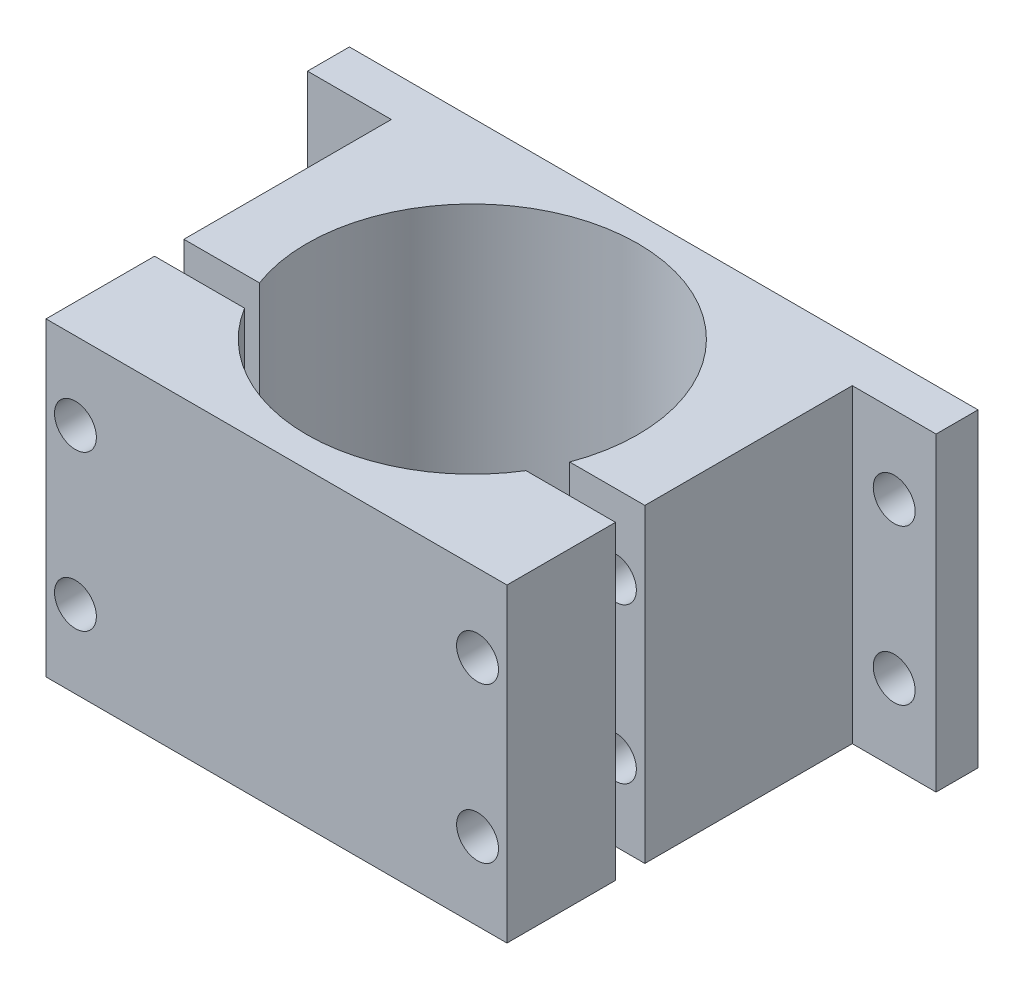
from build123d import *

# Parameters (mm, degrees)
SKETCH1_W              = 75
SKETCH1_H              = 37
BOSS_EXTRUDE1_DEPTH    = 5
SKETCH19_W             = 55
SKETCH19_H             = 37
BOSS_EXTRUDE5_DEPTH    = 41.2
SKETCH20_R             = 19.75
CUT_EXTRUDE7_DEPTH     = 71.069180101
SKETCH22_R             = 2.498129319
CUT_EXTRUDE8_DEPTH     = 25
SPLIT1_SURFACE_1_BACK  = 96.543
SPLIT1_SURFACE_1_DEPTH = 193.086
SPLIT1_SURFACE_2_BACK  = 96.543
SPLIT1_SURFACE_2_DEPTH = 193.086
SKETCH23_R             = 2.5
CUT_EXTRUDE9_DEPTH     = 59.702129433
SKETCH24_W             = 55
SKETCH24_H             = 3.5
CUT_EXTRUDE10_DEPTH    = 71.069180101


with BuildPart() as part:
    # Sketch1 → Boss-Extrude1 (new body)
    with BuildSketch(Plane.XY):
        Rectangle(SKETCH1_W, SKETCH1_H)
    extrude(amount=BOSS_EXTRUDE1_DEPTH)

    # Sketch19 → Boss-Extrude5 (add)
    with BuildSketch(Plane.XY.offset(5)):
        Rectangle(SKETCH19_W, SKETCH19_H)
    extrude(amount=BOSS_EXTRUDE5_DEPTH)

    # Sketch20 → Cut-Extrude7 (cut, through all)
    with BuildSketch(Plane(origin=(0, 18.5, 0), x_dir=(1, 0, 0), z_dir=(0, 1, 0))):
        with Locations(Location((0.023568345, -22.855008575, 0), (0, 0, 270))):
            Circle(SKETCH20_R)
    extrude(amount=-CUT_EXTRUDE7_DEPTH, mode=Mode.SUBTRACT)

    # Sketch22 → Cut-Extrude8 (cut)
    with BuildSketch(Plane.XY.offset(46.2)):
        with Locations((-23.988215828, 9.25)):
            Circle(SKETCH22_R)
        with Locations(Location((-23.988215828, -9.25, 0), (0, 0, 180))):
            Circle(SKETCH22_R)
        with Locations((23.988215828, -9.25)):
            Circle(SKETCH22_R)
        with Locations(Location((23.988215828, 9.25, 0), (0, 0, 180))):
            Circle(SKETCH22_R)
    extrude(amount=-CUT_EXTRUDE8_DEPTH, mode=Mode.SUBTRACT)


with BuildPart() as body_2:
    # Split1: the piece behind the surface
    add(part.part)
    # Split1 surface: a surface, the sketch's curves swept straight by 193.086 mm
    with BuildLine(Plane(origin=(0, 18.5, 0), x_dir=(1, 0, 0), z_dir=(0, 1, 0)).offset(-SPLIT1_SURFACE_1_BACK), mode=Mode.PRIVATE) as split1_surface_1_path:
        Line((-27.5, -33.248134685), (27.5, -33.248134685))
    split1_surface_1 = Shell.extrude(split1_surface_1_path.wire(), (0 * SPLIT1_SURFACE_1_DEPTH, 1 * SPLIT1_SURFACE_1_DEPTH, 0 * SPLIT1_SURFACE_1_DEPTH))
    split(bisect_by=split1_surface_1, keep=Keep.BOTTOM)


with BuildPart() as part_1:
    add(part.part)

    # Split1: split by a surface, the side it looks to stays
    # Split1 surface: a surface, the sketch's curves swept straight by 193.086 mm
    with BuildLine(Plane(origin=(0, 18.5, 0), x_dir=(1, 0, 0), z_dir=(0, 1, 0)).offset(-SPLIT1_SURFACE_2_BACK), mode=Mode.PRIVATE) as split1_surface_2_path:
        Line((-27.5, -33.248134685), (27.5, -33.248134685))
    split1_surface_2 = Shell.extrude(split1_surface_2_path.wire(), (0 * SPLIT1_SURFACE_2_DEPTH, 1 * SPLIT1_SURFACE_2_DEPTH, 0 * SPLIT1_SURFACE_2_DEPTH))
    split(bisect_by=split1_surface_2, keep=Keep.TOP)

    # Sketch23 → Cut-Extrude9 (cut, through all)
    with BuildSketch(Plane.XY.offset(5)):
        with Locations((32.5, -9.25)):
            Circle(SKETCH23_R)
        with Locations(Location((32.5, 9.25, 0), (0, 0, 180))):
            Circle(SKETCH23_R)
        with Locations(Location((-32.5, -9.25, 0), (0, 0, 180))):
            Circle(SKETCH23_R)
        with Locations((-32.5, 9.25)):
            Circle(SKETCH23_R)
    extrude(amount=-CUT_EXTRUDE9_DEPTH, mode=Mode.SUBTRACT)

    # Sketch24 → Cut-Extrude10 (cut, through all)
    with BuildSketch(Plane(origin=(0, 18.5, 0), x_dir=(1, 0, 0), z_dir=(0, 1, 0))):
        with Locations((0, -31.498134685)):
            Rectangle(SKETCH24_W, SKETCH24_H)
    extrude(amount=-CUT_EXTRUDE10_DEPTH, mode=Mode.SUBTRACT)


solid = Compound([body_2.part, part_1.part])
